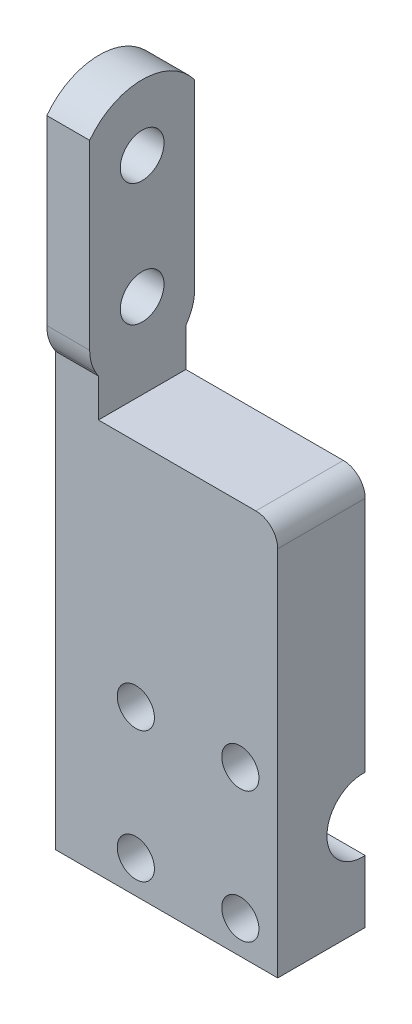
from build123d import *

# Parameters (mm, degrees)
SKETCH4_W               = 41
SKETCH4_H               = 45
SKETCH4_R               = 4.25
BOSS_EXTRUDE1_DEPTH     = 20
SKETCH6_W               = 9.8
SKETCH6_H               = 152.4
BOSS_EXTRUDE2_DEPTH     = 20
SKETCH7_R               = 5
BOSS_EXTRUDE3_DEPTH     = 9.8
SKETCH8_R               = 5
CUT_EXTRUDE2_DEPTH      = 15
SKETCH5_R               = 8.25
CUT_EXTRUDE1_DEPTH      = 65
BOSS_EXTRUDE4_DEPTH     = 20
CUT_EXTRUDE3_DEPTH      = 86
CUT_EXTRUDE3_DEPTH_BACK = 86
BOSS_EXTRUDE5_START     = -1.5
BOSS_EXTRUDE5_DEPTH     = 1.5
CUT_EXTRUDE4_DEPTH      = 13.5
SKETCH13_R              = 5
BOSS_EXTRUDE6_DEPTH     = 4
SKETCH14_R              = 4
CUT_EXTRUDE5_DEPTH      = 10
CUT_EXTRUDE6_DEPTH      = 15


with BuildPart() as part:
    # Sketch4 → Boss-Extrude1 (new body)
    with BuildSketch(Plane.XY):
        Rectangle(SKETCH4_W, SKETCH4_H)
        with Locations((-11.95, 14.95)):
            Circle(SKETCH4_R, mode=Mode.SUBTRACT)
        with Locations((11.95, 14.95)):
            Circle(SKETCH4_R, mode=Mode.SUBTRACT)
        with Locations((11.95, -14.95)):
            Circle(SKETCH4_R, mode=Mode.SUBTRACT)
        with Locations((-11.95, -14.95)):
            Circle(SKETCH4_R, mode=Mode.SUBTRACT)
    extrude(amount=BOSS_EXTRUDE1_DEPTH)

    # Sketch6 → Boss-Extrude2 (add)
    with BuildSketch(Plane(origin=(0, 0, 0), x_dir=(-1, 0, 0), z_dir=(0, 0, -1))):
        with Locations((25.4, 53.7)):
            Rectangle(SKETCH6_W, SKETCH6_H)
    extrude(amount=-BOSS_EXTRUDE2_DEPTH)

    # Sketch7 → Boss-Extrude3 (add)
    with BuildSketch(Plane(origin=(-20.5, 0, 0), x_dir=(0, 0, -1), z_dir=(1, 0, 0))):
        with Locations((-10, 114.9)):
            Circle(SKETCH7_R)
        with Locations((-10, 86.9)):
            Circle(SKETCH7_R)
        with BuildLine():
            Line((0, 76.2), (0.583845628, 77.176915135))
            ThreePointArc((0.583845628, 77.176915135), (1.639462026, 79.646010822), (2, 82.306982798))
            Line((2, 82.306982798), (2, 123.885290943))
            ThreePointArc((2, 123.885290943), (1.549421785, 126.853210006), (0.238291287, 129.553673135))
            Line((0.238291287, 129.553673135), (0, 129.9))
            Line((0, 129.9), (0, 76.2))
        make_face()
        with BuildLine():
            Line((-20, 76.2), (-20.583845628, 77.176915135))
            ThreePointArc((-20.583845628, 77.176915135), (-21.639462026, 79.646010822), (-22, 82.306982798))
            Line((-22, 82.306982798), (-22, 123.885290943))
            ThreePointArc((-22, 123.885290943), (-21.549421785, 126.853210006), (-20.238291287, 129.553673135))
            Line((-20.238291287, 129.553673135), (-20, 129.9))
            Line((-20, 129.9), (-20, 76.2))
        make_face()
    extrude(amount=-BOSS_EXTRUDE3_DEPTH)

    # Sketch8 → Cut-Extrude2 (cut)
    with BuildSketch(Plane(origin=(-20.5, 0, 0), x_dir=(0, 0, -1), z_dir=(1, 0, 0))):
        with Locations((-10, 86.9)):
            Circle(SKETCH8_R)
        with Locations((-10, 114.9)):
            Circle(SKETCH8_R)
    extrude(amount=-CUT_EXTRUDE2_DEPTH, mode=Mode.SUBTRACT)

    # Sketch5 → Cut-Extrude1 (cut)
    with BuildSketch(Plane(origin=(20.5, 0, 0), x_dir=(0, 0, -1), z_dir=(1, 0, 0))):
        with Locations((-0.5, 0)):
            Circle(SKETCH5_R)
    extrude(amount=-CUT_EXTRUDE1_DEPTH, mode=Mode.SUBTRACT)

    # Sketch9 → Boss-Extrude4 (add)
    with BuildSketch(Plane(origin=(0, 0, 0), x_dir=(-1, 0, 0), z_dir=(0, 0, -1))):
        with BuildLine():
            Line((-20.5, 22.5), (-20.5, 62.5))
            ThreePointArc((-20.5, 62.5), (-19.035533906, 66.035533906), (-15.5, 67.5))
            Line((-15.5, 67.5), (20.5, 67.5))
            Line((20.5, 67.5), (20.5, 22.5))
            Line((20.5, 22.5), (-20.5, 22.5))
        make_face()
    extrude(amount=-BOSS_EXTRUDE4_DEPTH)

    # Sketch10 → Cut-Extrude3 (cut, two sides: drawn at the far end of the back side and taken through both)
    with BuildSketch(Plane.XY.offset(-CUT_EXTRUDE3_DEPTH_BACK)):
        Polygon((-30.3, -22.5), (-26.3, -22.5), (-26.3, 157.593855938), (-61.075791469, 162.523409413), (-64.522830675, 37.584660103), align=None)
    extrude(amount=CUT_EXTRUDE3_DEPTH + CUT_EXTRUDE3_DEPTH_BACK, mode=Mode.SUBTRACT)

    # Sketch11 → Boss-Extrude5 (add)
    with BuildSketch(Plane.ZY.offset(26.3).offset(BOSS_EXTRUDE5_START)):
        with BuildLine():
            Line((0, -8.234834546), (0, 8.234834546))
            ThreePointArc((0, 8.234834546), (8.75, 0), (0, -8.234834546))
        make_face()
    extrude(amount=BOSS_EXTRUDE5_DEPTH)

    # Sketch12 → Cut-Extrude4 (cut)
    with BuildSketch(Plane(origin=(-20.5, 0, 0), x_dir=(0, 0, -1), z_dir=(1, 0, 0))):
        with BuildLine():
            Line((-22, 123.885290943), (-30.820305045, 123.885290943))
            Line((-30.820305045, 123.885290943), (-25.068984461, 136.818732695))
            Line((-25.068984461, 136.818732695), (-2.479535984, 134.912757399))
            Line((-2.479535984, 134.912757399), (8.997050859, 125.264275664))
            Line((8.997050859, 125.264275664), (2, 123.885290943))
            ThreePointArc((2, 123.885290943), (-10, 129.9), (-22, 123.885290943))
        make_face()
    extrude(amount=-CUT_EXTRUDE4_DEPTH, mode=Mode.SUBTRACT)

    # Sketch13 → Boss-Extrude6 (add)
    with BuildSketch(Plane.ZY.offset(26.3)):
        with BuildLine():
            Line((0, -22.5), (20, -22.5))
            Line((20, -22.5), (20, 76.2))
            Line((20, 76.2), (20.583845628, 77.176915135))
            ThreePointArc((20.583845628, 77.176915135), (21.639462026, 79.646010822), (22, 82.306982798))
            Line((22, 82.306982798), (22, 123.885290943))
            ThreePointArc((22, 123.885290943), (10, 129.9), (-2, 123.885290943))
            Line((-2, 123.885290943), (-2, 82.306982798))
            ThreePointArc((-2, 82.306982798), (-1.639462026, 79.646010822), (-0.583845628, 77.176915135))
            Line((-0.583845628, 77.176915135), (0, 76.2))
            Line((0, 76.2), (0, -22.5))
        make_face()
        with Locations(Location((10, 114.9, 0), (0, 0, 180))):
            Circle(SKETCH13_R, mode=Mode.SUBTRACT)
        with Locations(Location((10, 86.9, 0), (0, 0, 180))):
            Circle(SKETCH13_R, mode=Mode.SUBTRACT)
    extrude(amount=BOSS_EXTRUDE6_DEPTH)

    # Sketch14 → Cut-Extrude5 (cut)
    with BuildSketch(Plane.ZY.offset(30.3)):
        Circle(SKETCH14_R)
    extrude(amount=-CUT_EXTRUDE5_DEPTH, mode=Mode.SUBTRACT)

    # Sketch16 → Cut-Extrude6 (cut)
    with BuildSketch(Plane(origin=(0, 0, 0), x_dir=(-1, 0, 0), z_dir=(0, 0, -1))):
        with BuildLine():
            Line((-7.337559311, 35.883172827), (8.281826454, 54.105327978))
            ThreePointArc((8.281826454, 54.105327978), (8.734653676, 57.347267148), (5.97851601, 59.113315631))
            Line((5.97851601, 59.113315631), (-2.674541305, 59.113315631))
            ThreePointArc((-2.674541305, 59.113315631), (-9.745609117, 56.184383443), (-12.674541305, 49.113315631))
            Line((-12.674541305, 49.113315631), (-12.674541305, 37.857488931))
            ThreePointArc((-12.674541305, 37.857488931), (-10.693408521, 35.012260431), (-7.337559311, 35.883172827))
        make_face()
        with BuildLine():
            Line((4.245024065, 32.065048559), (11.254642469, 40.242729553))
            ThreePointArc((11.254642469, 40.242729553), (14.573244191, 41.103975455), (16.53238784, 38.290326924))
            Line((16.53238784, 38.290326924), (16.53238784, 30.11264593))
            ThreePointArc((16.53238784, 30.11264593), (15.653708183, 27.991325586), (13.53238784, 27.11264593))
            Line((13.53238784, 27.11264593), (6.522769436, 27.11264593))
            ThreePointArc((6.522769436, 27.11264593), (3.797222895, 28.859092558), (4.245024065, 32.065048559))
        make_face()
    extrude(amount=-CUT_EXTRUDE6_DEPTH, mode=Mode.SUBTRACT)


solid = part.part
